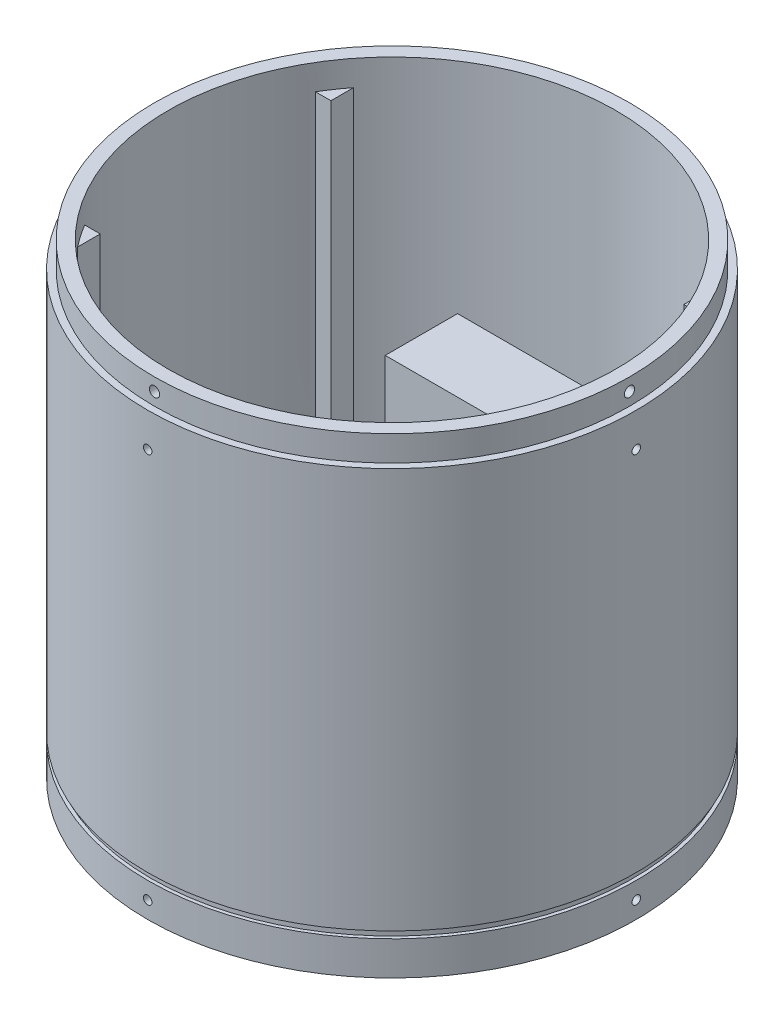
from build123d import *

# Parameters (mm, degrees)
SKETCH_6_R               = 72
SKETCH_6_R_2             = 70
EXTRUDE_1_DEPTH          = 130
SKETCH_6_15_R            = 70
SKETCH_6_15_R_2          = 66
EXTRUDE_2_DEPTH          = 137.5
SKETCH_6_16_R            = 66
EXTRUDE_3_DEPTH          = 3
EXTRUDE_6_DEPTH          = 130
PATTERN_CIRCULAR_1_COUNT = 4
SKETCH_33_W              = 1
SKETCH_33_H              = 2
PATTERN_CIRCULAR_2_COUNT = 4
SKETCH_40_W              = 72
SKETCH_40_H              = 21.317266744
EXTRUDE_8_DEPTH          = 70


with BuildPart() as part:
    # 草圖6 → 填料-伸長1 (new body)
    with BuildSketch(Plane(origin=(0, 0, 0), x_dir=(1, 0, 0), z_dir=(0, 1, 0))):
        with Locations(Location((0, 0, 0), (0, 0, 270))):
            Circle(SKETCH_6_R)
        with Locations(Location((0, 0, 0), (0, 0, 270))):
            Circle(SKETCH_6_R_2, mode=Mode.SUBTRACT)
    extrude(amount=EXTRUDE_1_DEPTH)

    # 草圖6<15> → 填料-伸長2 (add)
    with BuildSketch(Plane(origin=(0, 0, 0), x_dir=(1, 0, 0), z_dir=(0, 1, 0))):
        with Locations(Location((0, 0, 0), (0, 0, 270))):
            Circle(SKETCH_6_15_R)
        with Locations(Location((0, 0, 0), (0, 0, 270))):
            Circle(SKETCH_6_15_R_2, mode=Mode.SUBTRACT)
    extrude(amount=EXTRUDE_2_DEPTH)

    # 草圖6<16> → 填料-伸長3 (add)
    with BuildSketch(Plane(origin=(0, 0, 0), x_dir=(1, 0, 0), z_dir=(0, 1, 0))):
        with Locations(Location((0, 0, 0), (0, 0, 270))):
            Circle(SKETCH_6_16_R)
    extrude(amount=EXTRUDE_3_DEPTH)

    # 草圖9 → 填料-伸長6 (add)
    with BuildSketch(Plane(origin=(0, 0, 0), x_dir=(1, 0, 0), z_dir=(0, 1, 0))):
        with BuildLine():
            Line((-52, 34), (-52, 40.644802866))
            ThreePointArc((-52, 40.644802866), (-54.38584794, 37.392239086), (-56.568542495, 34))
            Line((-56.568542495, 34), (-52, 34))
        make_face()
        with BuildLine():
            Line((-52, -34), (-56.568542495, -34))
            ThreePointArc((-56.568542495, -34), (-54.38584794, -37.392239086), (-52, -40.644802866))
            Line((-52, -40.644802866), (-52, -34))
        make_face()
        with BuildLine():
            Line((56.568542495, -34), (52, -34))
            Line((52, -34), (52, -40.644802866))
            ThreePointArc((52, -40.644802866), (54.38584794, -37.392239086), (56.568542495, -34))
        make_face()
        with BuildLine():
            ThreePointArc((56.568542495, 34), (54.38584794, 37.392239086), (52, 40.644802866))
            Line((52, 40.644802866), (52, 34))
            Line((52, 34), (56.568542495, 34))
        make_face()
    extrude(amount=EXTRUDE_6_DEPTH)

    # 草圖31 → Ø2.5mm 定位孔3 (revolve, cut)
    with BuildSketch(Plane(origin=(70, 133.75, 0), x_dir=(0, 0, -1), z_dir=(0, 1, 0))):
        Polygon((0, 0), (0, 3.901290929), (1.5, 3), (1.5, 0), align=None)
    f_2_5mm_3 = revolve(axis=Axis((76.35, 133.75, 0), (-1, 0, 0)), mode=Mode.SUBTRACT)

    # 環狀複製排列1: Ø2.5mm 定位孔3 ×4 about axis
    pattern_circular_1_axis = Axis((0, 137.5, 0), (0, 1, 0))
    for i in range(1, PATTERN_CIRCULAR_1_COUNT):
        add(f_2_5mm_3.rotate(pattern_circular_1_axis, i * 360 / PATTERN_CIRCULAR_1_COUNT), mode=Mode.SUBTRACT)

    # 草圖33 → 除料-旋轉1 (revolve, cut)
    with BuildSketch(Plane.XY, mode=Mode.PRIVATE) as cut_revolve_1_sk:
        with Locations((-71.5, 11)):
            Rectangle(SKETCH_33_W, SKETCH_33_H)
    revolve(cut_revolve_1_sk.sketch.rotate(Axis((0, 137.5, 0), (0, -1, 0)), 270), axis=Axis((0, 137.5, 0), (0, -1, 0)), mode=Mode.SUBTRACT)

    # 草圖37 → M3x0.5  螺絲攻的螺孔鑽1 (revolve, cut)
    with BuildSketch(Plane(origin=(-72, 5, 0), x_dir=(0, 0, 1), z_dir=(0, 1, 0))):
        Polygon((0, 0), (0, 4.751075774), (1.25, 4), (1.25, 0), align=None)
    m3x0_5_1 = revolve(axis=Axis((-78.35, 5, 0), (1, 0, 0)), mode=Mode.SUBTRACT)

    # 環狀複製排列2: M3x0.5  螺絲攻的螺孔鑽1 ×4 about axis
    pattern_circular_2_axis = Axis((0, 137.5, 0), (0, -1, 0))
    for i in range(1, PATTERN_CIRCULAR_2_COUNT):
        add(m3x0_5_1.rotate(pattern_circular_2_axis, i * 360 / PATTERN_CIRCULAR_2_COUNT), mode=Mode.SUBTRACT)

    # 直線複製排列2 copy 1 sketch → 直線複製排列2 copy 1 (revolve, cut)
    with BuildSketch(Plane(origin=(0, 120, -72), x_dir=(-1, 0, 0), z_dir=(0, 1, 0))):
        Polygon((0, 0), (0, 4.751075774), (1.25, 4), (1.25, 0), align=None)
    revolve(axis=Axis((0, 120, -78.35), (0, 0, 1)), mode=Mode.SUBTRACT)

    # 直線複製排列2 copy 2 sketch → 直線複製排列2 copy 2 (revolve, cut)
    with BuildSketch(Plane(origin=(72, 120, 0), x_dir=(0, 0, -1), z_dir=(0, 1, 0))):
        Polygon((0, 0), (0, 4.751075774), (1.25, 4), (1.25, 0), align=None)
    revolve(axis=Axis((78.35, 120, 0), (-1, 0, 0)), mode=Mode.SUBTRACT)

    # 直線複製排列2 copy 3 sketch → 直線複製排列2 copy 3 (revolve, cut)
    with BuildSketch(Plane(origin=(0, 120, 72), x_dir=(1, 0, 0), z_dir=(0, 1, 0))):
        Polygon((0, 0), (0, 4.751075774), (1.25, 4), (1.25, 0), align=None)
    revolve(axis=Axis((0, 120, 78.35), (0, 0, -1)), mode=Mode.SUBTRACT)

    # 直線複製排列2 copy 4 sketch → 直線複製排列2 copy 4 (revolve, cut)
    with BuildSketch(Plane(origin=(-72, 120, 0), x_dir=(0, 0, 1), z_dir=(0, 1, 0))):
        Polygon((0, 0), (0, 4.751075774), (1.25, 4), (1.25, 0), align=None)
    revolve(axis=Axis((-78.35, 120, 0), (1, 0, 0)), mode=Mode.SUBTRACT)


with BuildPart() as body_2:
    # 草圖40 → 填料-伸長8 (new body)
    with BuildSketch(Plane(origin=(0, 3, 0), x_dir=(1, 0, 0), z_dir=(0, 1, 0))):
        with Locations((0, 44.658633372)):
            Rectangle(SKETCH_40_W, SKETCH_40_H)
    extrude(amount=EXTRUDE_8_DEPTH)


solid = Compound([part.part, body_2.part])
